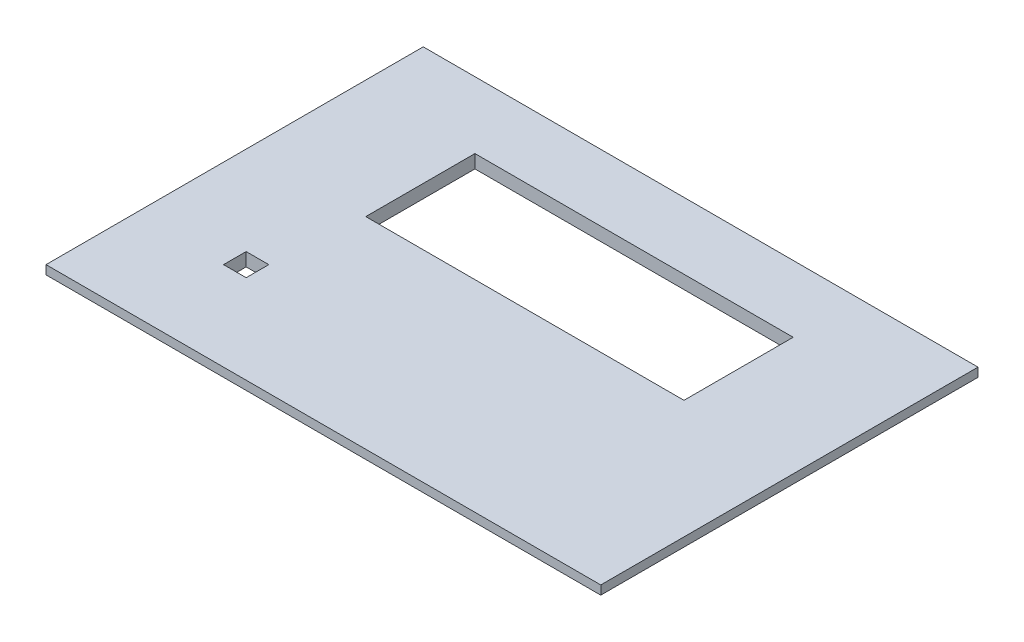
from build123d import *

# Parameters (mm, degrees)
ESBO_O1_W                = 115.9
ESBO_O1_H                = 75.9
RESSALTO_EXTRUS_O1_DEPTH = 1
ESBO_O2_W                = 125
ESBO_O2_H                = 85
RESSALTO_EXTRUS_O2_DEPTH = 2
ESBO_O3_W                = 71.7
ESBO_O3_H                = 24.6
ESBO_O3_W_2              = 5.1
ESBO_O3_H_2              = 5.1
CORTE_EXTRUS_O1_DEPTH    = 76.640597565


with BuildPart() as part:
    # Esboço1 → Ressalto-extrusão1 (new body)
    with BuildSketch(Plane(origin=(0, 0, 0), x_dir=(1, 0, 0), z_dir=(0, 1, 0))):
        Rectangle(ESBO_O1_W, ESBO_O1_H)
    extrude(amount=RESSALTO_EXTRUS_O1_DEPTH)

    # Esboço2 → Ressalto-extrusão2 (add)
    with BuildSketch(Plane(origin=(0, 1, 0), x_dir=(1, 0, 0), z_dir=(0, 1, 0))):
        Rectangle(ESBO_O2_W, ESBO_O2_H)
    extrude(amount=RESSALTO_EXTRUS_O2_DEPTH)

    # Esboço3 → Corte-extrusão1 (cut, through all)
    with BuildSketch(Plane(origin=(0, 3, 0), x_dir=(1, 0, 0), z_dir=(0, 1, 0))):
        with Locations((0, 15.2)):
            Rectangle(ESBO_O3_W, ESBO_O3_H)
        with Locations((-39.95, -19.95)):
            Rectangle(ESBO_O3_W_2, ESBO_O3_H_2)
    extrude(amount=-CORTE_EXTRUS_O1_DEPTH, mode=Mode.SUBTRACT)


solid = part.part
